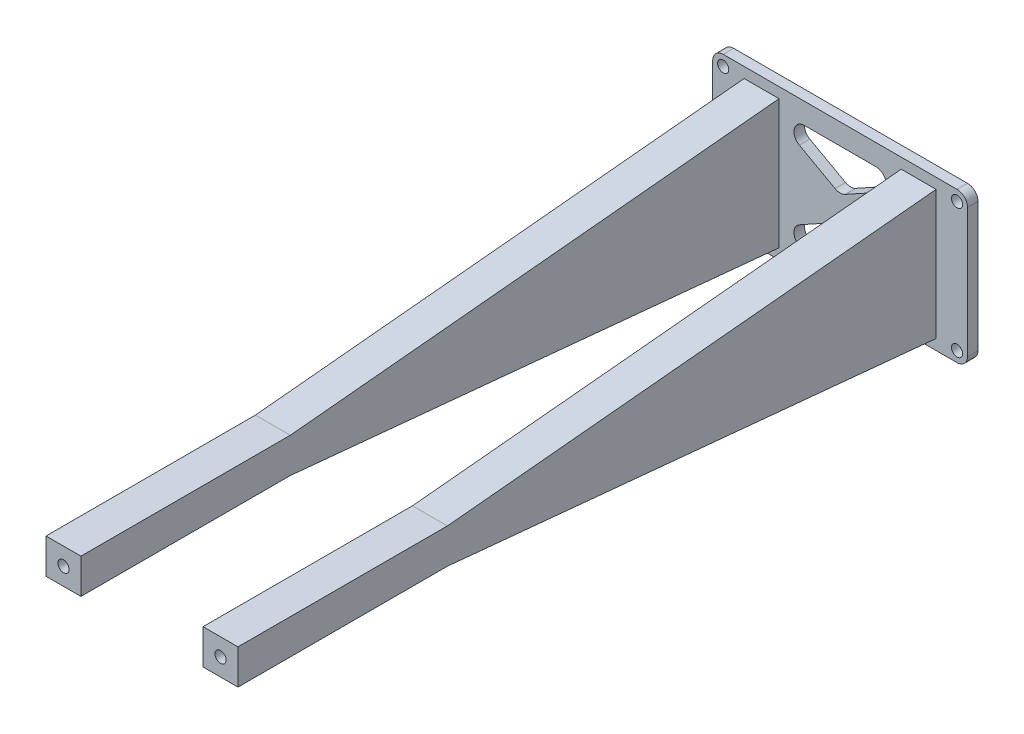
from build123d import *

# Parameters (mm, degrees)
SKETCH_1_R          = 1.6
EXTRUDE_1_DEPTH     = 3
SKETCH_2_W          = 10
SKETCH_2_H          = 10
EXTRUDE_3_DEPTH     = 140
EXTRUDE_4_DEPTH     = 10
EXTRUDE_5_DEPTH     = 10
EXTRUDE_6_DEPTH     = 10
SKETCH_9_W          = 10
SKETCH_9_H          = 10
EXTRUDE_7_DEPTH     = 60
SKETCH_10_W         = 10
SKETCH_10_H         = 10
EXTRUDE_8_DEPTH     = 60
SKETCH_11_R         = 1.6
CUT_EXTRUDE_3_DEPTH = 20
SKETCH_12_R         = 1.6
CUT_EXTRUDE_4_DEPTH = 20


with BuildPart() as part:
    # 草图1 → 凸台-拉伸1 (new body)
    with BuildSketch(Plane.XY):
        with BuildLine():
            Line((33.5, 21.5), (-33.5, 21.5))
            ThreePointArc((-33.5, 21.5), (-35.621320344, 20.621320344), (-36.5, 18.5))
            Line((-36.5, 18.5), (-36.5, -18.5))
            ThreePointArc((-36.5, -18.5), (-35.621320344, -20.621320344), (-33.5, -21.5))
            Line((-33.5, -21.5), (33.5, -21.5))
            ThreePointArc((33.5, -21.5), (35.621320344, -20.621320344), (36.5, -18.5))
            Line((36.5, -18.5), (36.5, 18.5))
            ThreePointArc((36.5, 18.5), (35.621320344, 20.621320344), (33.5, 21.5))
        make_face()
        with Locations((33.5, 18.5)):
            Circle(SKETCH_1_R, mode=Mode.SUBTRACT)
        with Locations((-33.5, 18.5)):
            Circle(SKETCH_1_R, mode=Mode.SUBTRACT)
        with Locations(Location((33.5, -18.5, 0), (0, 0, 180))):
            Circle(SKETCH_1_R, mode=Mode.SUBTRACT)
        with Locations(Location((-33.5, -18.5, 0), (0, 0, 180))):
            Circle(SKETCH_1_R, mode=Mode.SUBTRACT)
        with BuildLine():
            Line((1.450268103, -4.227949809), (11.673904999, -9.873838841))
            ThreePointArc((11.673904999, -9.873838841), (13.1286742, -13.248837941), (10.223636896, -15.5))
            Line((10.223636896, -15.5), (-10.223636896, -15.5))
            ThreePointArc((-10.223636896, -15.5), (-13.1286742, -13.248837941), (-11.673904999, -9.873838841))
            Line((-11.673904999, -9.873838841), (-1.450268103, -4.227949809))
            ThreePointArc((-1.450268103, -4.227949809), (0, -3.854110968), (1.450268103, -4.227949809))
        make_face(mode=Mode.SUBTRACT)
        with BuildLine():
            Line((11.673904999, 9.873838841), (1.450268103, 4.227949809))
            ThreePointArc((1.450268103, 4.227949809), (0, 3.854110968), (-1.450268103, 4.227949809))
            Line((-1.450268103, 4.227949809), (-11.673904999, 9.873838841))
            ThreePointArc((-11.673904999, 9.873838841), (-13.1286742, 13.248837941), (-10.223636896, 15.5))
            Line((-10.223636896, 15.5), (10.223636896, 15.5))
            ThreePointArc((10.223636896, 15.5), (13.1286742, 13.248837941), (11.673904999, 9.873838841))
        make_face(mode=Mode.SUBTRACT)
    extrude(amount=EXTRUDE_1_DEPTH)

    # 草图2 → 凸台-拉伸3 (add)
    with BuildSketch(Plane.XY.offset(3)):
        with Locations((-22.5, 0)):
            Rectangle(SKETCH_2_W, SKETCH_2_H)
        with Locations((22.5, 0)):
            Rectangle(SKETCH_2_W, SKETCH_2_H)
    extrude(amount=EXTRUDE_3_DEPTH)

    # 草图5 → 凸台-拉伸4 (add)
    with BuildSketch(Plane.ZY.offset(27.5)):
        Polygon((3, 18.5), (3, 5), (143, 5), align=None)
    extrude(amount=-EXTRUDE_4_DEPTH)

    # 草图6 → 凸台-拉伸5 (add)
    with BuildSketch(Plane.ZY.offset(27.5)):
        Polygon((3, -5), (3, -18.5), (143, -5), align=None)
    extrude(amount=-EXTRUDE_5_DEPTH)

    # 草图7 → 凸台-拉伸6 (add)
    with BuildSketch(Plane(origin=(27.5, 0, 0), x_dir=(0, 0, -1), z_dir=(1, 0, 0))):
        Polygon((-143, 5), (-3, 5), (-3, 18.5), align=None)
        Polygon((-143, -5), (-3, -18.5), (-3, -5), align=None)
    extrude(amount=-EXTRUDE_6_DEPTH)

    # 草图9 → 凸台-拉伸7 (add)
    with BuildSketch(Plane.XY.offset(143)):
        with Locations((-22.5, 0)):
            Rectangle(SKETCH_9_W, SKETCH_9_H)
    extrude(amount=EXTRUDE_7_DEPTH)

    # 草图10 → 凸台-拉伸8 (add)
    with BuildSketch(Plane.XY.offset(143)):
        with Locations((22.5, 0)):
            Rectangle(SKETCH_10_W, SKETCH_10_H)
    extrude(amount=EXTRUDE_8_DEPTH)

    # 草图11 → 切除-拉伸3 (cut)
    with BuildSketch(Plane.XY.offset(203)):
        with Locations((-22.5, 0)):
            Circle(SKETCH_11_R)
    extrude(amount=-CUT_EXTRUDE_3_DEPTH, mode=Mode.SUBTRACT)

    # 草图12 → 切除-拉伸4 (cut)
    with BuildSketch(Plane.XY.offset(203)):
        with Locations((22.5, 0)):
            Circle(SKETCH_12_R)
    extrude(amount=-CUT_EXTRUDE_4_DEPTH, mode=Mode.SUBTRACT)


solid = part.part
